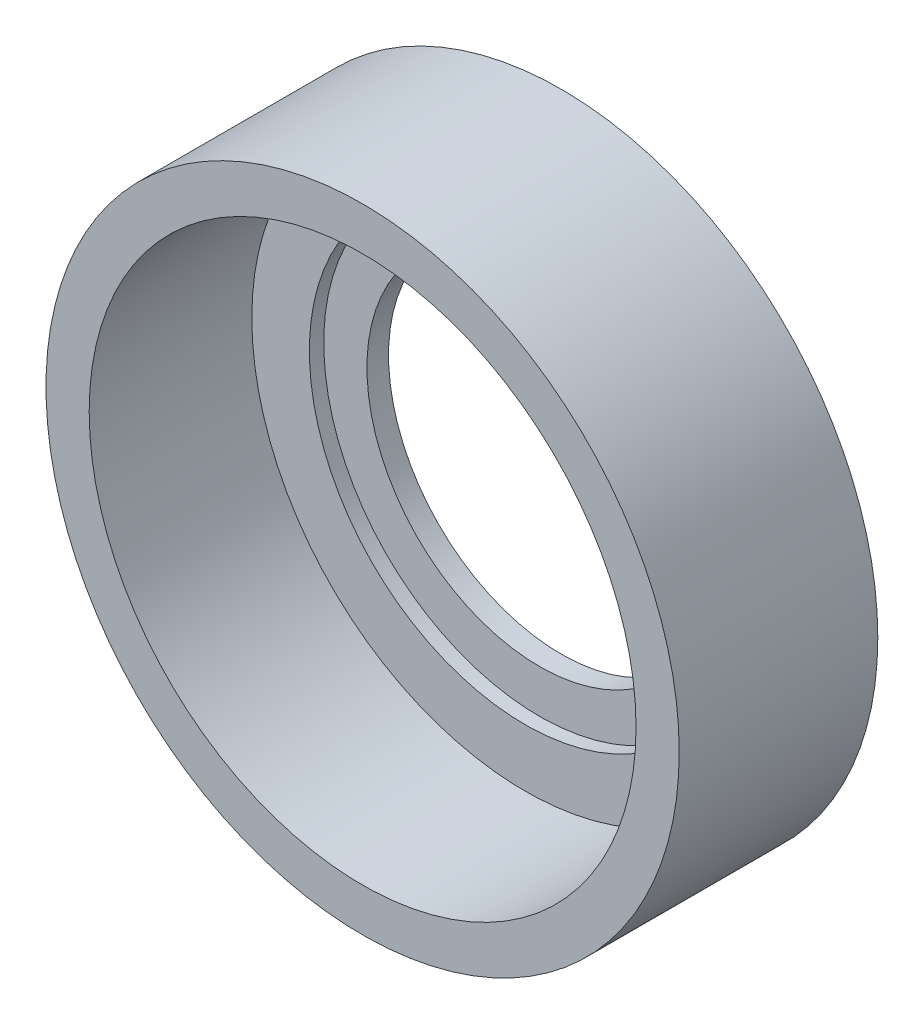
from build123d import *

# Parameters (mm, degrees)
SKETCH1_R           = 11
SKETCH1_R_2         = 6
BOSS_EXTRUDE1_DEPTH = 0.75
SKETCH2_R           = 11
SKETCH2_R_2         = 7.5
BOSS_EXTRUDE2_DEPTH = 0.5
SKETCH3_R           = 11
SKETCH3_R_2         = 9.5
BOSS_EXTRUDE3_DEPTH = 5.65


with BuildPart() as part:
    # Sketch1 → Boss-Extrude1 (new body)
    with BuildSketch(Plane.XY):
        Circle(SKETCH1_R)
        Circle(SKETCH1_R_2, mode=Mode.SUBTRACT)
    extrude(amount=BOSS_EXTRUDE1_DEPTH)

    # Sketch2 → Boss-Extrude2 (add)
    with BuildSketch(Plane.XY.offset(0.75)):
        Circle(SKETCH2_R)
        Circle(SKETCH2_R_2, mode=Mode.SUBTRACT)
    extrude(amount=BOSS_EXTRUDE2_DEPTH)

    # Sketch3 → Boss-Extrude3 (add)
    with BuildSketch(Plane.XY.offset(1.25)):
        Circle(SKETCH3_R)
        Circle(SKETCH3_R_2, mode=Mode.SUBTRACT)
    extrude(amount=BOSS_EXTRUDE3_DEPTH)


solid = part.part
